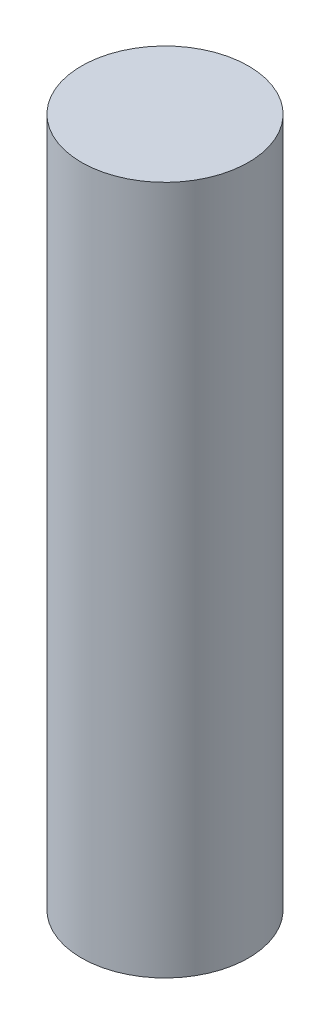
from build123d import *

# Parameters (mm, degrees)
SKETCH1_W = 4
SKETCH1_H = 33


with BuildPart() as part:
    # Sketch1 → Revolve1 (revolve)
    with BuildSketch(Plane(origin=(0, 0, 0), x_dir=(0, 0, -1), z_dir=(1, 0, 0)), mode=Mode.PRIVATE) as revolve1_sk:
        with Locations((2, 14.144444444)):
            Rectangle(SKETCH1_W, SKETCH1_H)
    revolve(revolve1_sk.sketch.rotate(Axis((0, 6.488888889, 0), (0, -1, 0)), 180), axis=Axis((0, 6.488888889, 0), (0, -1, 0)))


solid = part.part
